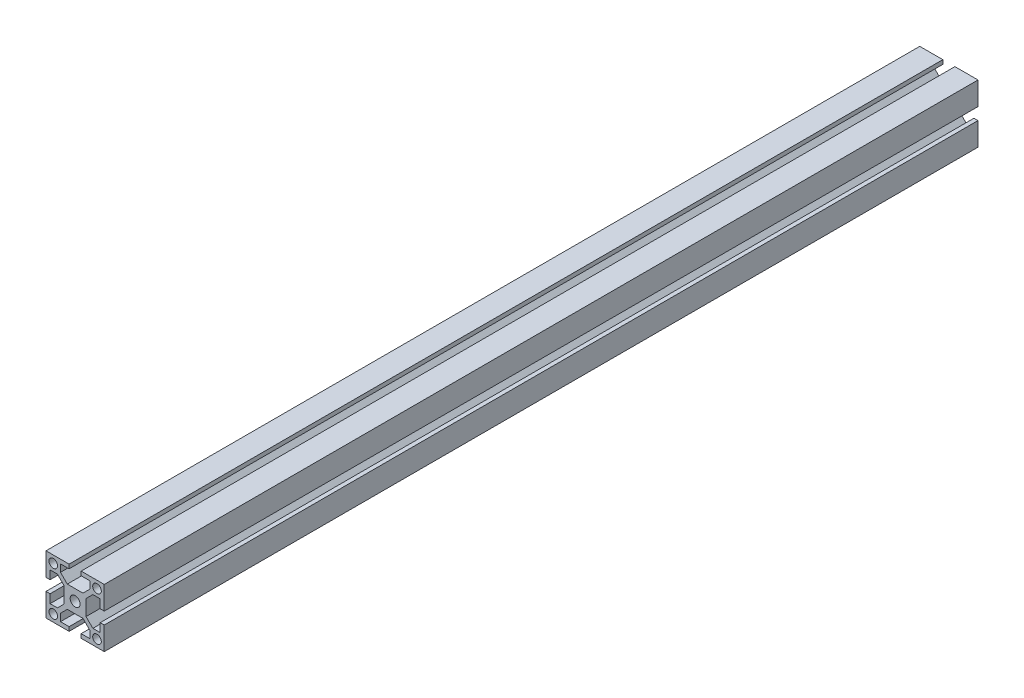
from build123d import *

# Parameters (mm, degrees)
SKETCH_1_R      = 3.4
SKETCH_1_R_2    = 2.95
EXTRUDE_1_DEPTH = 600


with BuildPart() as part:
    # 草图1 → 凸台-拉伸1 (new body)
    with BuildSketch(Plane.XY):
        Polygon((-5.378679656, -7.5), (5.378679656, -7.5), (10.05, -12.171320344), (10.05, -17.2), (4.15, -17.2), (4.15, -20), (20, -20), (20, -4.15), (17.2, -4.15), (17.2, -10.05), (12.171320344, -10.05), (7.5, -5.378679656), (7.5, 5.378679656), (12.171320344, 10.05), (17.2, 10.05), (17.2, 4.15), (20, 4.15), (20, 20), (4.15, 20), (4.15, 17.2), (10.05, 17.2), (10.05, 12.171320344), (5.378679656, 7.5), (-5.378679656, 7.5), (-10.05, 12.171320344), (-10.05, 17.2), (-4.15, 17.2), (-4.15, 20), (-20, 20), (-20, 4.15), (-17.2, 4.15), (-17.2, 10.05), (-12.171320344, 10.05), (-7.5, 5.378679656), (-7.5, -5.378679656), (-12.171320344, -10.05), (-17.2, -10.05), (-17.2, -4.15), (-20, -4.15), (-20, -20), (-4.15, -20), (-4.15, -17.2), (-10.05, -17.2), (-10.05, -12.171320344), align=None)
        Circle(SKETCH_1_R, mode=Mode.SUBTRACT)
        with Locations((15.025, 15.025)):
            Circle(SKETCH_1_R_2, mode=Mode.SUBTRACT)
        with Locations(Location((-15.025, 15.025, 0), (0, 0, 180))):
            Circle(SKETCH_1_R_2, mode=Mode.SUBTRACT)
        with Locations((-15.025, -15.025)):
            Circle(SKETCH_1_R_2, mode=Mode.SUBTRACT)
        with Locations(Location((15.025, -15.025, 0), (0, 0, 180))):
            Circle(SKETCH_1_R_2, mode=Mode.SUBTRACT)
    extrude(amount=EXTRUDE_1_DEPTH)


solid = part.part
